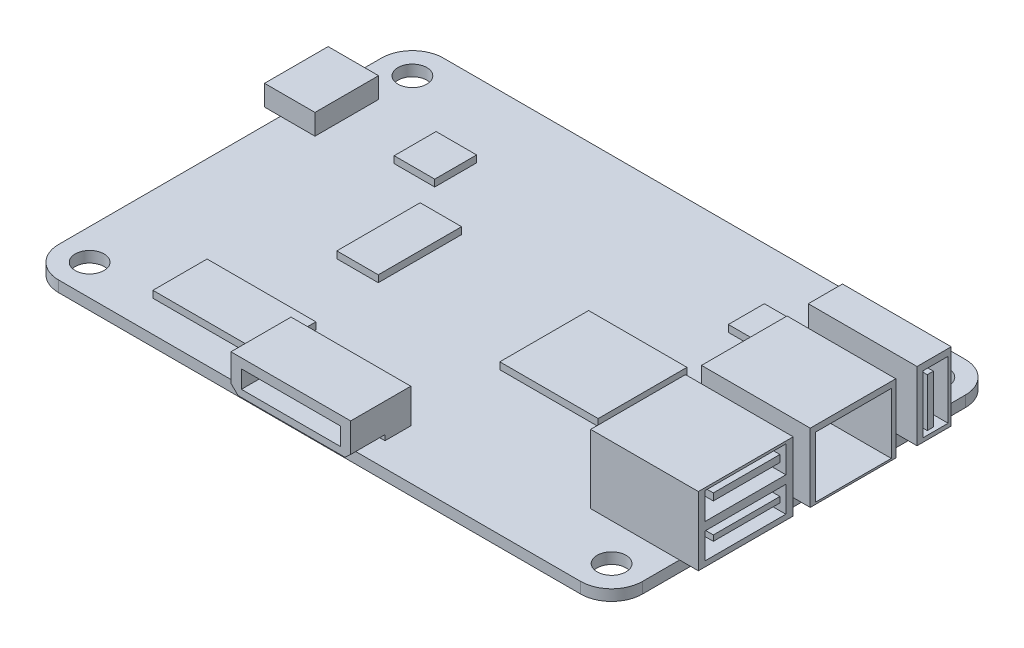
from build123d import *

# Parameters (mm, degrees)
SKETCH_1_R          = 2.1
EXTRUDE_1_DEPTH     = 1.6
SKETCH_2_W          = 15.831082037
SKETCH_2_H          = 12.45501042
SKETCH_2_W_2        = 15.680188414
SKETCH_2_H_2        = 13.80676649
SKETCH_2_H_3        = 4.979489554
EXTRUDE_2_DEPTH     = 10
SKETCH_4_W          = 11.752987814
SKETCH_4_H          = 3.899349988
SKETCH_4_W_2        = 9.690175718
SKETCH_4_H_2        = 1.018486937
SKETCH_4_W_3        = 11.742918051
SKETCH_4_H_3        = 3.771361158
SKETCH_4_H_4        = 0.81478955
CUT_EXTRUDE_1_DEPTH = 10
SKETCH_5_W          = 11.02482594
SKETCH_5_H          = 8.828308894
CUT_EXTRUDE_3_DEPTH = 10
SKETCH_6_W          = 3.67494198
SKETCH_6_H          = 8.448142483
SKETCH_6_W_2        = 0.887054961
SKETCH_6_H_2        = 7.054198973
CUT_EXTRUDE_4_DEPTH = 10
SKETCH_7_W          = 14.31905698
SKETCH_7_H          = 12.92692644
SKETCH_7_W_2        = 6.032565672
SKETCH_7_H_2        = 12.131423274
SKETCH_7_W_3        = 5.899981811
SKETCH_7_H_3        = 6.098857603
SKETCH_7_W_4        = 5.303354437
SKETCH_7_H_4        = 5.237062506
SKETCH_7_W_5        = 15.84377138
SKETCH_7_H_5        = 7.888739725
EXTRUDE_3_DEPTH     = 1
SKETCH_8_W          = 17.434777712
SKETCH_8_H          = 8.750534821
EXTRUDE_4_DEPTH     = 5
SKETCH_9_W          = 14.45164084
SKETCH_9_H          = 2.585385288
CUT_EXTRUDE_5_DEPTH = 5
SKETCH_10_W         = 7.345813671
SKETCH_10_H         = 9.262112889
EXTRUDE_5_DEPTH     = 3
SKETCH_11_W         = 7.769719093
SKETCH_11_H         = 1.711972004
CUT_EXTRUDE_6_DEPTH = 3


with BuildPart() as part:
    # 草图1 → 凸台-拉伸1 (new body)
    with BuildSketch(Plane(origin=(0, 0, 0), x_dir=(1, 0, 0), z_dir=(0, 1, 0))):
        with BuildLine():
            Line((-38, -28), (38, -28))
            ThreePointArc((38, -28), (41.181980515, -26.681980515), (42.5, -23.5))
            Line((42.5, -23.5), (42.5, 23.5))
            ThreePointArc((42.5, 23.5), (41.181980515, 26.681980515), (38, 28))
            Line((38, 28), (-38, 28))
            ThreePointArc((-38, 28), (-41.181980515, 26.681980515), (-42.5, 23.5))
            Line((-42.5, 23.5), (-42.5, -23.5))
            ThreePointArc((-42.5, -23.5), (-41.181980515, -26.681980515), (-38, -28))
        make_face()
        with Locations(Location((-38, 23.5, 0), (0, 0, 270))):
            Circle(SKETCH_1_R, mode=Mode.SUBTRACT)
        with Locations(Location((38, 23.5, 0), (0, 0, 270))):
            Circle(SKETCH_1_R, mode=Mode.SUBTRACT)
        with Locations(Location((38, -23.5, 0), (0, 0, 270))):
            Circle(SKETCH_1_R, mode=Mode.SUBTRACT)
        with Locations(Location((-38, -23.5, 0), (0, 0, 270))):
            Circle(SKETCH_1_R, mode=Mode.SUBTRACT)
    extrude(amount=EXTRUDE_1_DEPTH)

    # 草图2 → 凸台-拉伸2 (add)
    with BuildSketch(Plane(origin=(0, 1.6, 0), x_dir=(1, 0, 0), z_dir=(0, 1, 0))):
        with Locations((37.470005744, 4.267247856)):
            Rectangle(SKETCH_2_W, SKETCH_2_H)
        with Locations((37.394558932, -11.196205219)):
            Rectangle(SKETCH_2_W_2, SKETCH_2_H_2)
        with Locations((37.470005744, 16.077817111)):
            Rectangle(SKETCH_2_W, SKETCH_2_H_3)
    extrude(amount=EXTRUDE_2_DEPTH)

    # 草图4 → 切除-拉伸1 (cut)
    # profile 1 of 2: a face of its own
    with BuildSketch(Plane(origin=(45.234653139, 0, 0), x_dir=(0, 0, -1), z_dir=(1, 0, 0))):
        with Locations((-11.23099462, 9.288009883)):
            Rectangle(SKETCH_4_W, SKETCH_4_H)
        with Locations((-11.072577375, 9.826352979)):
            Rectangle(SKETCH_4_W_2, SKETCH_4_H_2, mode=Mode.SUBTRACT)
    # profile 2 of 2: a face of its own
    with BuildSketch(Plane(origin=(45.234653139, 0, 0), x_dir=(0, 0, -1), z_dir=(1, 0, 0))):
        with Locations((-11.236029502, 4.259569612)):
            Rectangle(SKETCH_4_W_3, SKETCH_4_H_3)
        with Locations((-11.072577375, 4.632069598)):
            Rectangle(SKETCH_4_W_2, SKETCH_4_H_4, mode=Mode.SUBTRACT)
    extrude(amount=-CUT_EXTRUDE_1_DEPTH, mode=Mode.SUBTRACT)

    # 草图5 → 切除-拉伸3 (cut)
    with BuildSketch(Plane(origin=(45.385546762, 0, 0), x_dir=(0, 0, -1), z_dir=(1, 0, 0))):
        with Locations((4.329673022, 6.294177297)):
            Rectangle(SKETCH_5_W, SKETCH_5_H)
    extrude(amount=-CUT_EXTRUDE_3_DEPTH, mode=Mode.SUBTRACT)

    # 草图6 → 切除-拉伸4 (cut)
    with BuildSketch(Plane(origin=(45.385546762, 0, 0), x_dir=(0, 0, -1), z_dir=(1, 0, 0))):
        with Locations((16.283794635, 6.399779078)):
            Rectangle(SKETCH_6_W, SKETCH_6_H)
        with Locations((15.523461812, 6.294177298)):
            Rectangle(SKETCH_6_W_2, SKETCH_6_H_2, mode=Mode.SUBTRACT)
    extrude(amount=-CUT_EXTRUDE_4_DEPTH, mode=Mode.SUBTRACT)

    # 草图7 → 凸台-拉伸3 (add)
    with BuildSketch(Plane(origin=(0, 1.6, 0), x_dir=(1, 0, 0), z_dir=(0, 1, 0))):
        with Locations((12.579817698, -0.729211235)):
            Rectangle(SKETCH_7_W, SKETCH_7_H)
        with Locations((-17.417280836, 0.994378957)):
            Rectangle(SKETCH_7_W_2, SKETCH_7_H_2)
        with Locations((-25.306020561, 14.153327154)):
            Rectangle(SKETCH_7_W_3, SKETCH_7_H_3)
        with Locations((20.004513911, 16.771858407)):
            Rectangle(SKETCH_7_W_4, SKETCH_7_H_4)
        with Locations((-20.93075315, -19.489827555)):
            Rectangle(SKETCH_7_W_5, SKETCH_7_H_5)
    extrude(amount=EXTRUDE_3_DEPTH)

    # 草图8 → 凸台-拉伸4 (add)
    with BuildSketch(Plane(origin=(0, 1.6, 0), x_dir=(1, 0, 0), z_dir=(0, 1, 0))):
        with Locations((-2.700472273, -25.129807113)):
            Rectangle(SKETCH_8_W, SKETCH_8_H)
    extrude(amount=EXTRUDE_4_DEPTH)

    # 草图9 → 切除-拉伸5 (cut)
    with BuildSketch(Plane.XY.offset(29.505074523)):
        Polygon((-11.417861129, 1.6), (-11.417861129, 2.627524922), (-10.390336207, 1.6), align=None)
        with Locations((-2.667326308, 3.920217566)):
            Rectangle(SKETCH_9_W, SKETCH_9_H)
        Polygon((6.016916583, 1.6), (6.016916583, 2.370567657), (5.192747103, 1.6), align=None)
    extrude(amount=-CUT_EXTRUDE_5_DEPTH, mode=Mode.SUBTRACT)

    # 草图10 → 凸台-拉伸5 (add)
    with BuildSketch(Plane(origin=(0, 1.6, 0), x_dir=(1, 0, 0), z_dir=(0, 1, 0))):
        with Locations((-41.156730333, 13.42606725)):
            Rectangle(SKETCH_10_W, SKETCH_10_H)
    extrude(amount=EXTRUDE_5_DEPTH)

    # 草图11 → 切除-拉伸6 (cut)
    with BuildSketch(Plane.ZY.offset(44.829637168)):
        with Locations((-13.398155788, 2.916901541)):
            Rectangle(SKETCH_11_W, SKETCH_11_H)
    extrude(amount=-CUT_EXTRUDE_6_DEPTH, mode=Mode.SUBTRACT)


solid = part.part
